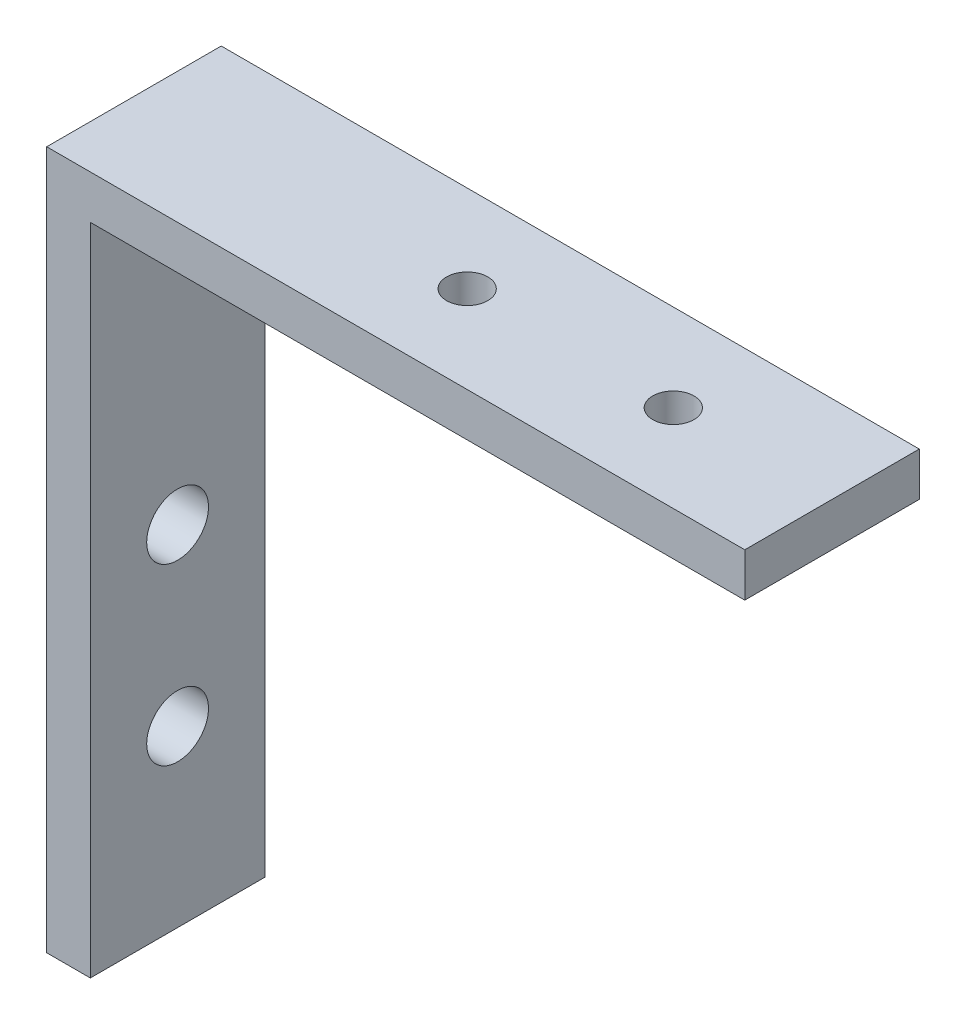
from build123d import *

# Parameters (mm, degrees)
EXTRUDE_THIN1_DEPTH = 12.7
CUT_EXTRUDE1_REACH  = 74.956
SKETCH2_R           = 2.25
CUT_EXTRUDE2_REACH  = 74.956
SKETCH6_R           = 1.5


with BuildPart() as part:
    # Sketch1 → Extrude-Thin1 (new body)
    with BuildSketch(Plane.XY):
        Polygon((0, 0), (0, 50.8), (50.8, 50.8), (50.8, 47.625), (3.175, 47.625), (3.175, 0), align=None)
    extrude(amount=EXTRUDE_THIN1_DEPTH)

    # Sketch2 → Cut-Extrude1 (cut, up to next)
    with BuildSketch(Plane.ZY, mode=Mode.PRIVATE) as cut_extrude1_sk1:
        with Locations((6.35, 12.7)):
            Circle(SKETCH2_R)
    cut_extrude1_tool1 = extrude(cut_extrude1_sk1.sketch, amount=-CUT_EXTRUDE1_REACH, mode=Mode.PRIVATE) & part.part
    # Sketch2 → Cut-Extrude1 (cut, up to next)
    with BuildSketch(Plane.ZY, mode=Mode.PRIVATE) as cut_extrude1_sk2:
        with Locations((6.35, 25.4)):
            Circle(SKETCH2_R)
    cut_extrude1_tool2 = extrude(cut_extrude1_sk2.sketch, amount=-CUT_EXTRUDE1_REACH, mode=Mode.PRIVATE) & part.part
    add(cut_extrude1_tool1.solids().sort_by_distance((0, 12.7, 6.35))[0], mode=Mode.SUBTRACT)
    add(cut_extrude1_tool2.solids().sort_by_distance((0, 25.4, 6.35))[0], mode=Mode.SUBTRACT)

    # Sketch6 → Cut-Extrude2 (cut, up to next)
    with BuildSketch(Plane(origin=(0, 50.8, 0), x_dir=(1, 0, 0), z_dir=(0, 1, 0)), mode=Mode.PRIVATE) as cut_extrude2_sk1:
        with Locations(Location((24.25, -6.35, 0), (0, 0, 270))):
            Circle(SKETCH6_R)
    cut_extrude2_tool1 = extrude(cut_extrude2_sk1.sketch, amount=-CUT_EXTRUDE2_REACH, mode=Mode.PRIVATE) & part.part
    # Sketch6 → Cut-Extrude2 (cut, up to next)
    with BuildSketch(Plane(origin=(0, 50.8, 0), x_dir=(1, 0, 0), z_dir=(0, 1, 0)), mode=Mode.PRIVATE) as cut_extrude2_sk2:
        with Locations(Location((39.25, -6.35, 0), (0, 0, 270))):
            Circle(SKETCH6_R)
    cut_extrude2_tool2 = extrude(cut_extrude2_sk2.sketch, amount=-CUT_EXTRUDE2_REACH, mode=Mode.PRIVATE) & part.part
    add(cut_extrude2_tool1.solids().sort_by_distance((24.25, 50.8, 6.35))[0], mode=Mode.SUBTRACT)
    add(cut_extrude2_tool2.solids().sort_by_distance((39.25, 50.8, 6.35))[0], mode=Mode.SUBTRACT)


solid = part.part
